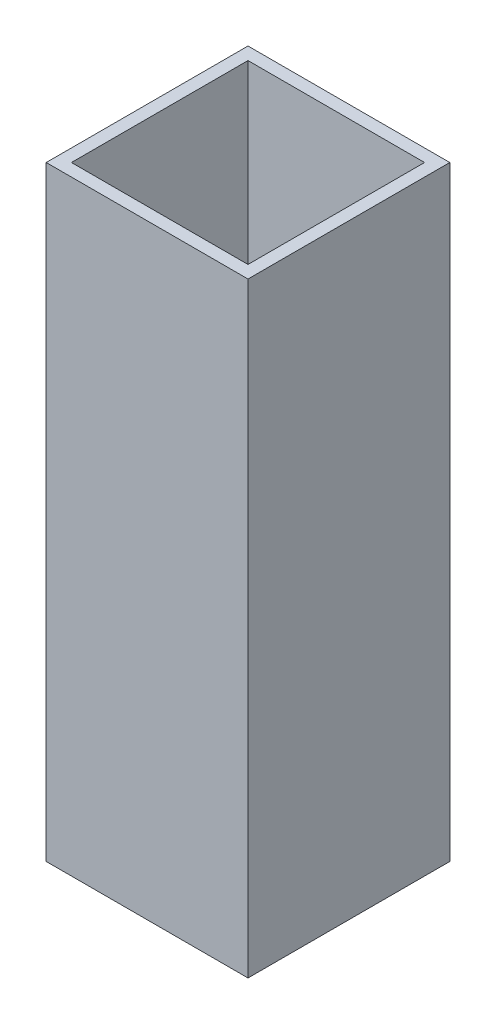
from build123d import *

# Parameters (mm, degrees)
SKETCH1_W           = 25.4
SKETCH1_H           = 25.4
SKETCH1_W_2         = 22.225
SKETCH1_H_2         = 22.225
BOSS_EXTRUDE1_DEPTH = 76.2


with BuildPart() as part:
    # Sketch1 → Boss-Extrude1 (new body)
    with BuildSketch(Plane(origin=(0, 0, 0), x_dir=(1, 0, 0), z_dir=(0, 1, 0))):
        Rectangle(SKETCH1_W, SKETCH1_H)
        Rectangle(SKETCH1_W_2, SKETCH1_H_2, mode=Mode.SUBTRACT)
    extrude(amount=BOSS_EXTRUDE1_DEPTH)


solid = part.part
